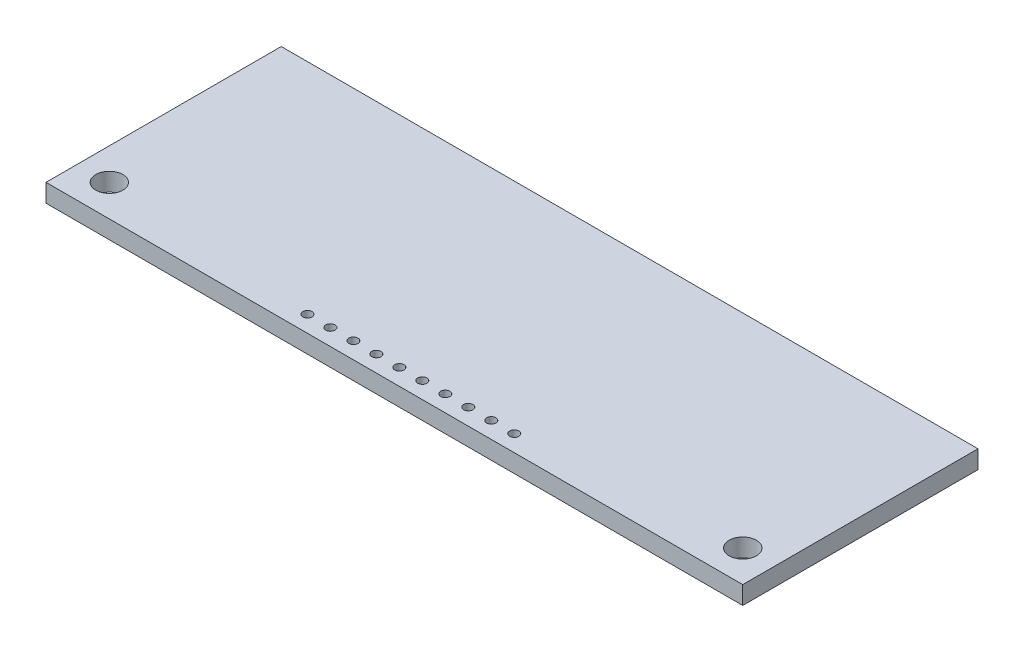
from build123d import *

# Parameters (mm, degrees)
SKETCH1_W           = 77
SKETCH1_H           = 26
BOSS_EXTRUDE1_DEPTH = 2
SKETCH2_R           = 1.5
CUT_EXTRUDE1_DEPTH  = 2
SKETCH3_R           = 0.51
CUT_EXTRUDE2_DEPTH  = 2


with BuildPart() as part:
    # Sketch1 → Boss-Extrude1 (new body)
    with BuildSketch(Plane(origin=(0, 0, 0), x_dir=(1, 0, 0), z_dir=(0, 1, 0))):
        with Locations((38.5, -13)):
            Rectangle(SKETCH1_W, SKETCH1_H)
    extrude(amount=BOSS_EXTRUDE1_DEPTH)

    # Sketch2 → Cut-Extrude1 (cut)
    with BuildSketch(Plane(origin=(0, 2, 0), x_dir=(1, 0, 0), z_dir=(0, 1, 0))):
        with Locations((3.5, -22.5)):
            Circle(SKETCH2_R)
        with Locations((73.5, -22.5)):
            Circle(SKETCH2_R)
    extrude(amount=-CUT_EXTRUDE1_DEPTH, mode=Mode.SUBTRACT)

    # Sketch3 → Cut-Extrude2 (cut)
    with BuildSketch(Plane(origin=(0, 2, 0), x_dir=(1, 0, 0), z_dir=(0, 1, 0))):
        with Locations((37.23, -24.179660029)):
            Circle(SKETCH3_R)
        with Locations((34.69, -24.179660029)):
            Circle(SKETCH3_R)
        with Locations((32.15, -24.179660029)):
            Circle(SKETCH3_R)
        with Locations((29.61, -24.179660029)):
            Circle(SKETCH3_R)
        with Locations((27.07, -24.179660029)):
            Circle(SKETCH3_R)
        with Locations((39.77, -24.179660029)):
            Circle(SKETCH3_R)
        with Locations((42.31, -24.179660029)):
            Circle(SKETCH3_R)
        with Locations((44.85, -24.179660029)):
            Circle(SKETCH3_R)
        with Locations((47.39, -24.179660029)):
            Circle(SKETCH3_R)
        with Locations((49.93, -24.179660029)):
            Circle(SKETCH3_R)
    extrude(amount=-CUT_EXTRUDE2_DEPTH, mode=Mode.SUBTRACT)


solid = part.part
